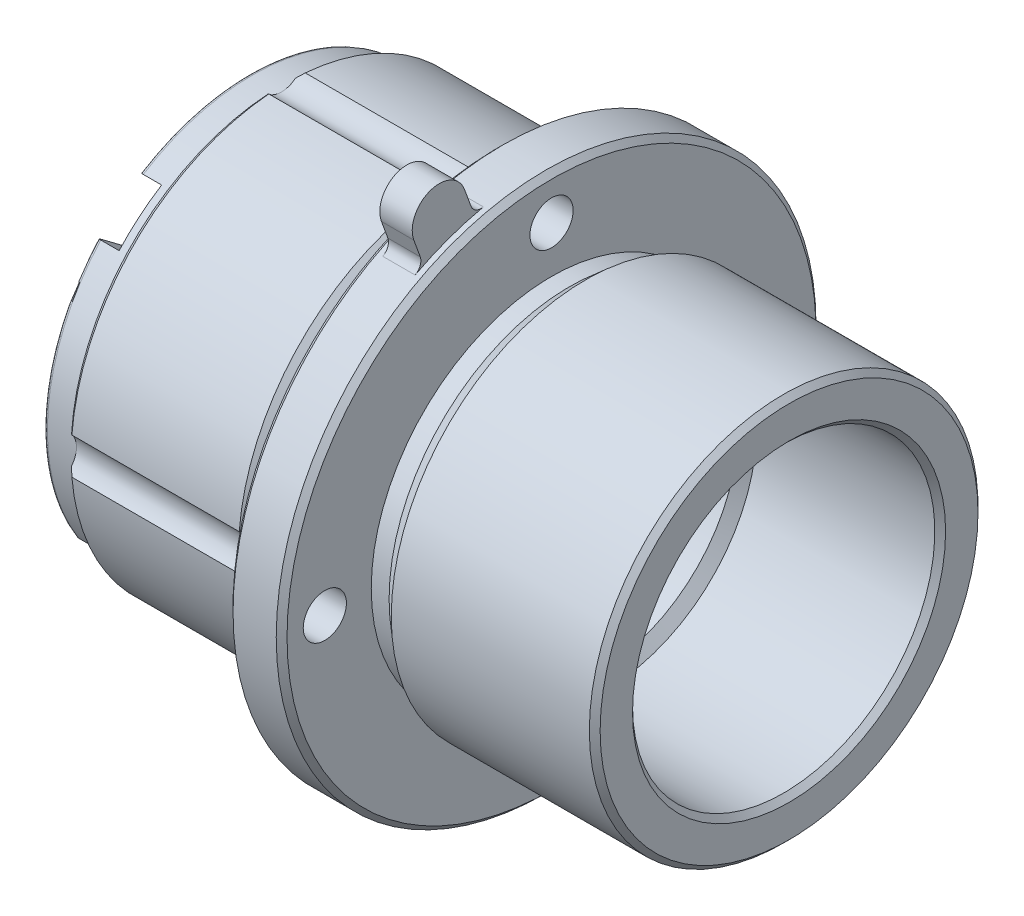
from build123d import *

# Parameters (mm, degrees)
CHAMFER1_SIZE       = 1.27
FILLET1_R           = 0.762
SKETCH2_R           = 5.08
CUT_EXTRUDE1_DEPTH  = 115.553718465
CIRPATTERN1_COUNT   = 4
CUT_EXTRUDE2_DEPTH  = 5.08
CIRPATTERN2_COUNT   = 4
BOSS_EXTRUDE1_DEPTH = 7.62
FILLET2_R           = 2.54


with BuildPart() as part:
    # Sketch1 → Base-Revolve (revolve)
    with BuildSketch(Plane.XY, mode=Mode.PRIVATE) as base_revolve_sk:
        Polygon((0, 35.56), (0, 48.26), (7.62, 48.26), (7.62, 50.8), (48.26, 50.8), (50.8, 48.26), (58.42, 48.26), (58.42, 63.5), (71.12, 63.5), (71.12, 42.416108007), (75.319090909, 42.416108007), (79.129090909, 45.72), (127, 45.72), (127, 35.56), (83.82, 35.56), (81.915, 33.02), (63.5, 33.02), (63.5, 30.48), (38.1, 30.48), (38.1, 38.1), (10.16, 38.1), (10.16, 35.56), align=None)
    revolve(base_revolve_sk.sketch.rotate(Axis((0, 0, 0), (1, 0, 0)), 90), axis=Axis((0, 0, 0), (1, 0, 0)))

    # Chamfer1
    chamfer1_edges = [part.edges().sort_by_distance(p)[0] for p in [
        (38.1, 0, -30.48),
        (127, 0, -35.56),
        (127, 0, -45.72),
        (71.12, 0, -63.5),
        (58.42, 0, -63.5),
        (7.62, 0, -50.8),
        (0, 0, -35.56),
    ]]
    chamfer(chamfer1_edges, length=CHAMFER1_SIZE)

    # Fillet1
    fillet1_edges = [part.edges().sort_by_distance(p)[0] for p in [
        (0, 0, -48.26),
    ]]
    fillet(fillet1_edges, radius=FILLET1_R)

    # Sketch2 → Cut-Extrude1 (cut, through all)
    with BuildSketch(Plane(origin=(71.12, 0, 0), x_dir=(0, 0, -1), z_dir=(1, 0, 0))):
        with Locations((53.34, 0)):
            Circle(SKETCH2_R)
    cut_extrude1 = extrude(amount=-CUT_EXTRUDE1_DEPTH, mode=Mode.SUBTRACT)

    # CirPattern1: Cut-Extrude1 ×4 about axis
    cirpattern1_axis = Axis((0, 0, 0), (1, 0, 0))
    for i in range(1, CIRPATTERN1_COUNT):
        add(cut_extrude1.rotate(cirpattern1_axis, i * 360 / CIRPATTERN1_COUNT), mode=Mode.SUBTRACT)

    # Sketch5 → Cut-Extrude2 (cut)
    with BuildSketch(Plane.ZY):
        Polygon((45.72, 55.88), (53.34, 45.72), (10.668, 13.716), (3.048, 23.876), align=None)
    cut_extrude2 = extrude(amount=-CUT_EXTRUDE2_DEPTH, mode=Mode.SUBTRACT)

    # CirPattern2: Cut-Extrude2 ×4 about axis
    cirpattern2_axis = Axis((0, 0, 0), (1, 0, 0))
    for i in range(1, CIRPATTERN2_COUNT):
        add(cut_extrude2.rotate(cirpattern2_axis, i * 360 / CIRPATTERN2_COUNT), mode=Mode.SUBTRACT)

    # Sketch7 → Boss-Extrude1 (add)
    with BuildSketch(Plane(origin=(68.58, 0, 0), x_dir=(0, 0, -1), z_dir=(1, 0, 0))):
        with BuildLine():
            Line((-29.857155153, 63.465701652), (-27.576463003, 57.199551469))
            ThreePointArc((-27.576463003, 57.199551469), (-21.718279101, 59.67048142), (-15.642366719, 61.543207289))
            Line((-15.642366719, 61.543207289), (-17.923058869, 67.809357472))
            ThreePointArc((-17.923058869, 67.809357472), (-26.061934921, 71.604577704), (-29.857155153, 63.465701652))
        make_face()
    extrude(amount=-BOSS_EXTRUDE1_DEPTH)

    # Fillet2
    fillet2_edges = [part.edges().sort_by_distance(p)[0] for p in [
        (64.77, 61.543207289, 15.642366719),
        (64.77, 57.199551469, 27.576463003),
    ]]
    fillet(fillet2_edges, radius=FILLET2_R)


solid = part.part
